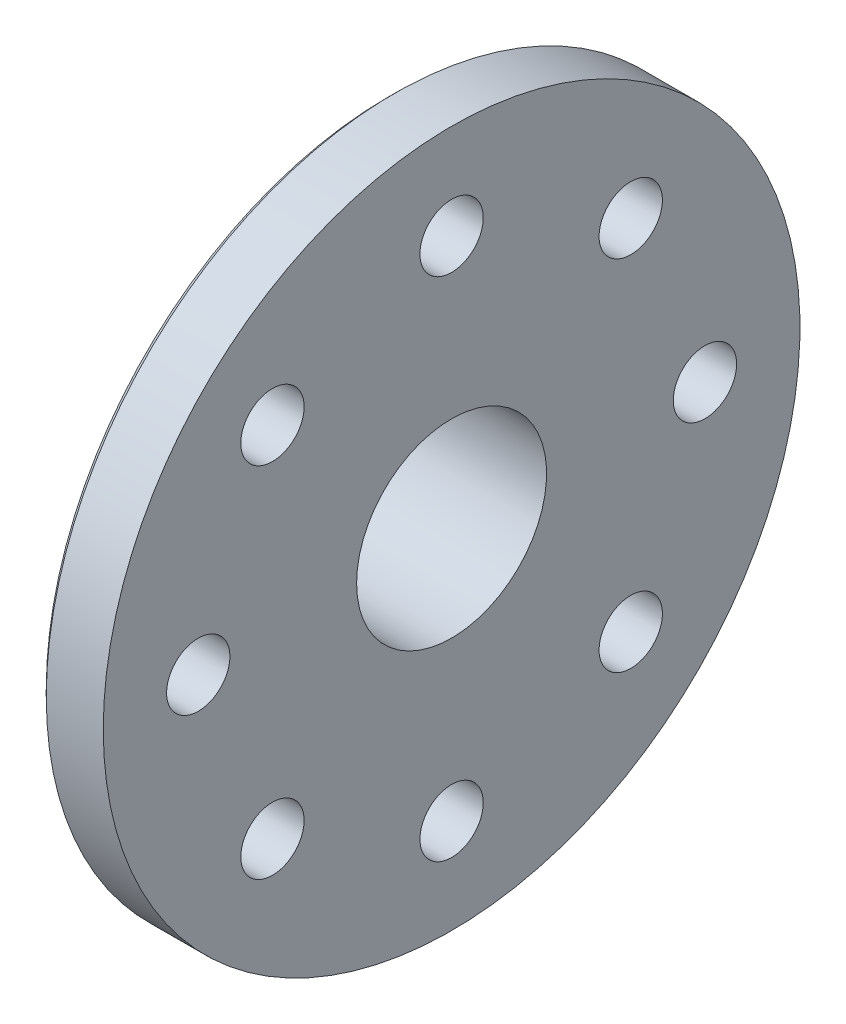
from build123d import *

# Parameters (mm, degrees)
SKETCH2_R          = 1
CUT_EXTRUDE1_DEPTH = 16.842979518
CIRPATTERN1_COUNT  = 8
CHAMFER1_SIZE      = 0.2


with BuildPart() as part:
    # Sketch1 → Revolve1 (revolve)
    with BuildSketch(Plane.XY, mode=Mode.PRIVATE) as revolve1_sk:
        Polygon((1, 11), (-1, 11), (-1, 3.75), (-4, 3.75), (-4, 1.5), (-3.5, 1.5), (-3.5, 3), (1, 3), align=None)
    revolve(revolve1_sk.sketch.rotate(Axis((0, 0, 0), (1, 0, 0)), 90), axis=Axis((0, 0, 0), (1, 0, 0)))

    # Sketch2 → Cut-Extrude1 (cut, through all)
    with BuildSketch(Plane.ZY.offset(1)):
        with Locations((0, 8)):
            Circle(SKETCH2_R)
    cut_extrude1 = extrude(amount=-CUT_EXTRUDE1_DEPTH, mode=Mode.SUBTRACT)

    # CirPattern1: Cut-Extrude1 ×8 about axis
    cirpattern1_axis = Axis((0, 0, 0), (1, 0, 0))
    for i in range(1, CIRPATTERN1_COUNT):
        add(cut_extrude1.rotate(cirpattern1_axis, i * 360 / CIRPATTERN1_COUNT), mode=Mode.SUBTRACT)

    # Chamfer1
    chamfer1_edges = [part.edges().sort_by_distance(p)[0] for p in [
        (-1, 8, -1),
        (-1, 4.949747468, -6.363961031),
        (-1, -1, -8),
        (-1, -6.363961031, -4.949747468),
        (-1, -8, 1),
        (-1, -4.949747468, 6.363961031),
        (-1, 1, 8),
        (-1, 6.363961031, 4.949747468),
        (-4, 0, -3.75),
        (-1, 0, -11),
    ]]
    chamfer(chamfer1_edges, length=CHAMFER1_SIZE)


solid = part.part
